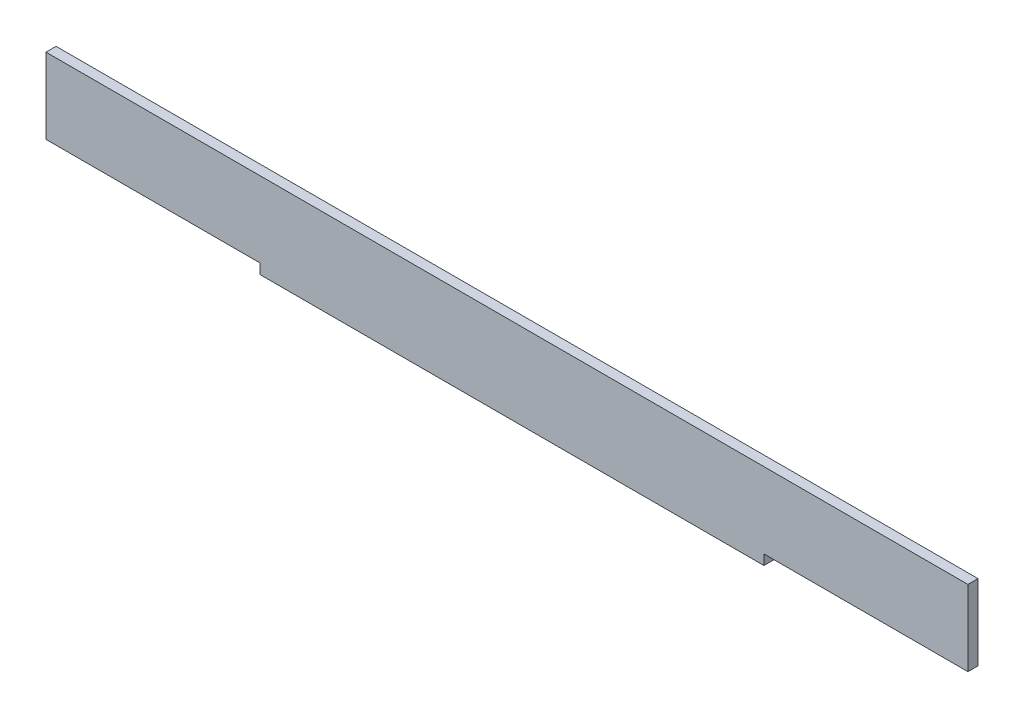
from build123d import *

# Parameters (mm, degrees)
BOSS_EXTRUDE1_DEPTH = 4


with BuildPart() as part:
    # Sketch1 → Boss-Extrude1 (new body)
    with BuildSketch(Plane.XY):
        Polygon((0, 0), (200, 0), (200, 4), (281, 4), (281, 34), (200, 34), (0, 34), (-85, 34), (-85, 4), (0, 4), align=None)
    extrude(amount=BOSS_EXTRUDE1_DEPTH)


solid = part.part
